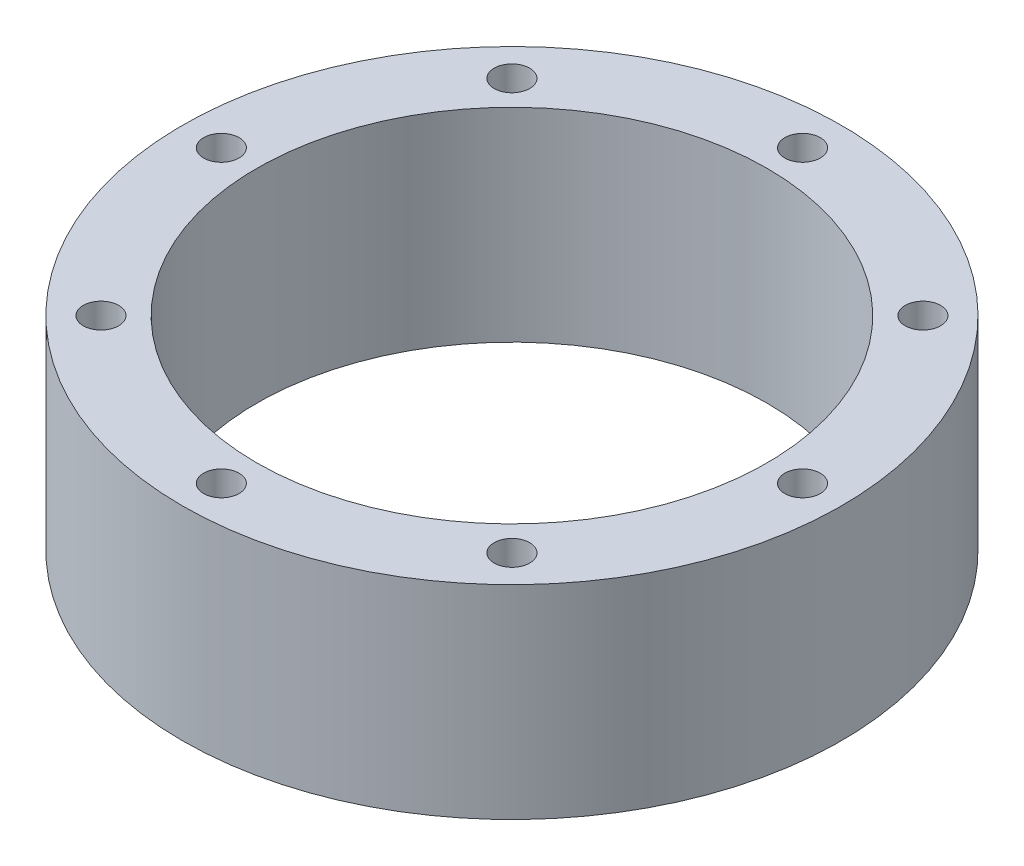
from build123d import *

# Parameters (mm, degrees)
SKETCH1_R           = 46.5
SKETCH1_R_2         = 36
BOSS_EXTRUDE1_DEPTH = 28.7
SKETCH2_R           = 2.5
CUT_EXTRUDE1_DEPTH  = 72.750888496


with BuildPart() as part:
    # Sketch1 → Boss-Extrude1 (new body)
    with BuildSketch(Plane(origin=(0, 0, 0), x_dir=(1, 0, 0), z_dir=(0, 1, 0))):
        with Locations(Location((0, 0, 0), (0, 0, 270))):
            Circle(SKETCH1_R)
        with Locations(Location((0, 0, 0), (0, 0, 270))):
            Circle(SKETCH1_R_2, mode=Mode.SUBTRACT)
    extrude(amount=BOSS_EXTRUDE1_DEPTH)

    # Sketch2 → Cut-Extrude1 (cut, through all)
    with BuildSketch(Plane(origin=(0, 28.7, 0), x_dir=(1, 0, 0), z_dir=(0, 1, 0))):
        with Locations(Location((0, 41, 0), (0, 0, 270))):
            Circle(SKETCH2_R)
        with Locations(Location((28.991378029, 28.991378029, 0), (0, 0, 270))):
            Circle(SKETCH2_R)
        with Locations(Location((41, 0, 0), (0, 0, 270))):
            Circle(SKETCH2_R)
        with Locations(Location((28.991378029, -28.991378029, 0), (0, 0, 270))):
            Circle(SKETCH2_R)
        with Locations(Location((0, -41, 0), (0, 0, 270))):
            Circle(SKETCH2_R)
        with Locations(Location((-28.991378029, -28.991378029, 0), (0, 0, 270))):
            Circle(SKETCH2_R)
        with Locations(Location((-41, 0, 0), (0, 0, 270))):
            Circle(SKETCH2_R)
        with Locations(Location((-28.991378029, 28.991378029, 0), (0, 0, 270))):
            Circle(SKETCH2_R)
    extrude(amount=-CUT_EXTRUDE1_DEPTH, mode=Mode.SUBTRACT)


solid = part.part
